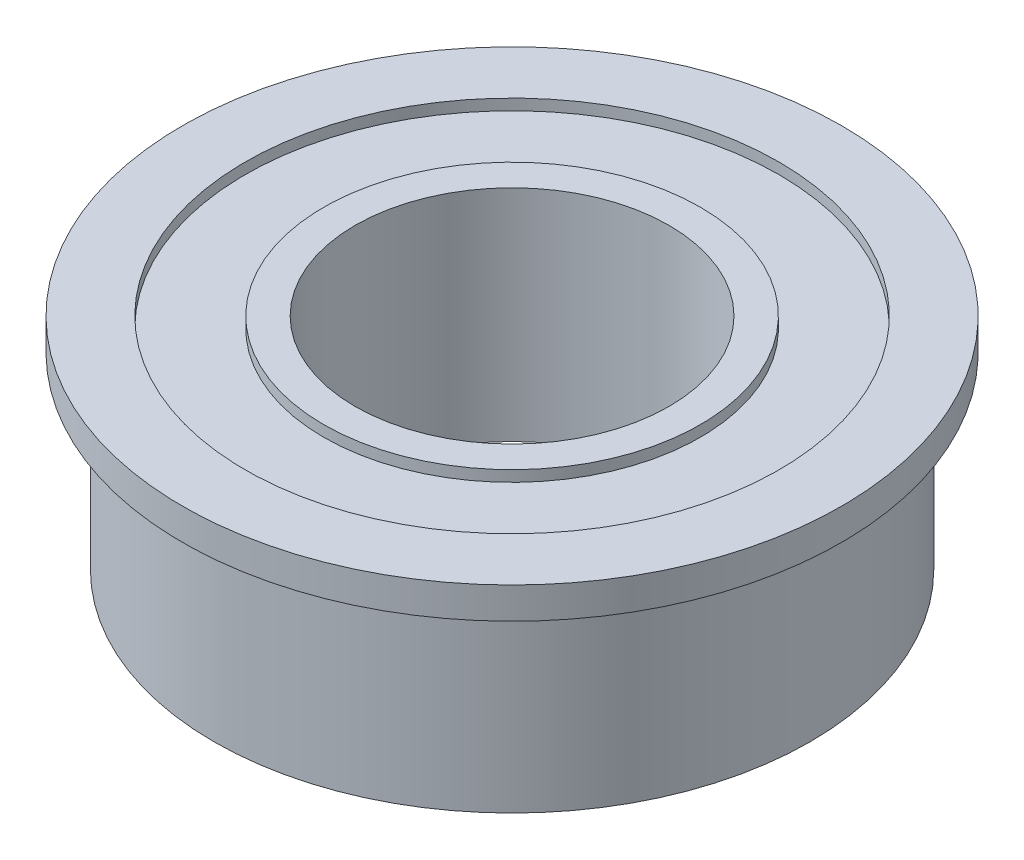
from build123d import *


with BuildPart() as part:
    # 草图2 → 旋转1 (revolve)
    with BuildSketch(Plane.XY, mode=Mode.PRIVATE) as revolve_1_sk:
        Polygon((5, 3.5), (5, -3.5), (6, -3.5), (6, -3.15), (8.5, -3.15), (8.5, -3.5), (9.5, -3.5), (9.5, 2.5), (10.5, 2.5), (10.5, 3.5), (9.5, 3.5), (8.5, 3.5), (8.5, 3.15), (6, 3.15), (6, 3.5), align=None)
    revolve(revolve_1_sk.sketch.rotate(Axis((0, 0, 0), (0, 1, 0)), 90), axis=Axis((0, 0, 0), (0, 1, 0)))


solid = part.part
